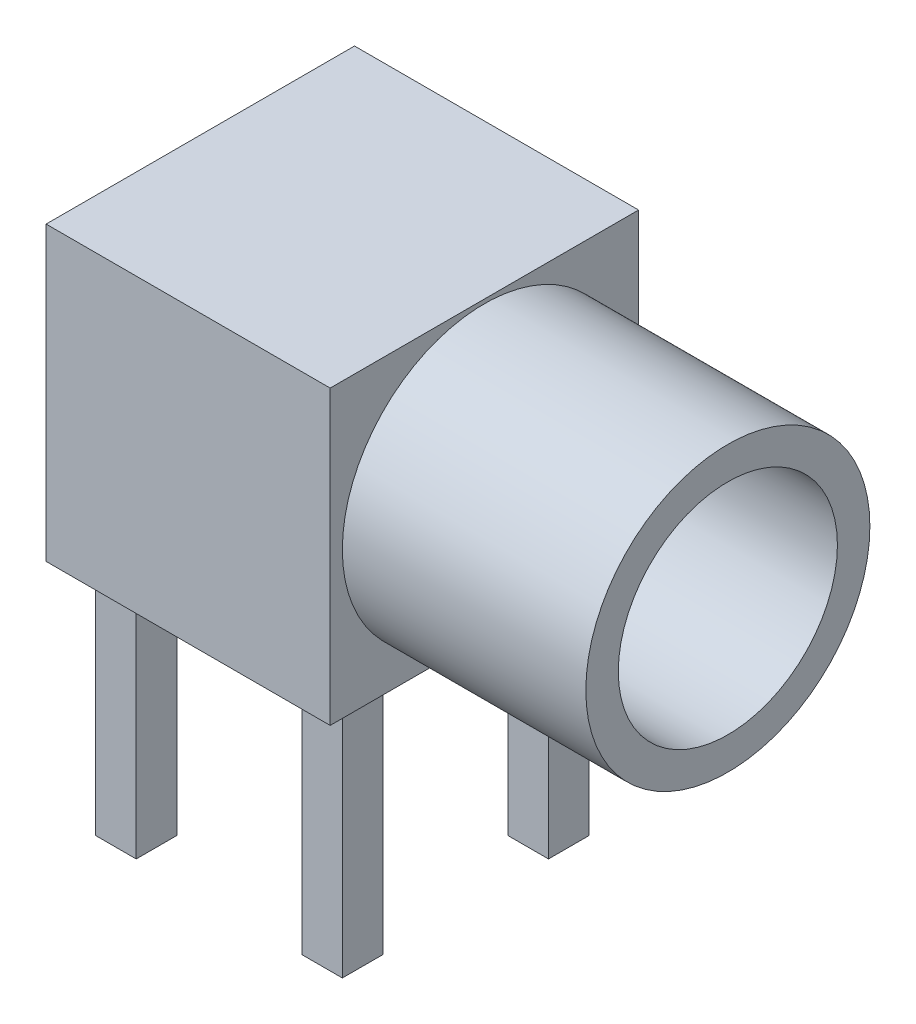
from build123d import *

# Parameters (mm, degrees)
SKETCH1_W           = 3.5
SKETCH1_H           = 3.8
BOSS_EXTRUDE1_DEPTH = 3.6
SKETCH2_R           = 1.75
SKETCH2_R_2         = 1.35
BOSS_EXTRUDE2_DEPTH = 3
SKETCH3_W           = 0.5
SKETCH3_H           = 0.5
BOSS_EXTRUDE3_DEPTH = 3


with BuildPart() as part:
    # Sketch1 → Boss-Extrude1 (new body)
    with BuildSketch(Plane(origin=(0, 0, 0), x_dir=(1, 0, 0), z_dir=(0, 1, 0))):
        Rectangle(SKETCH1_W, SKETCH1_H)
    extrude(amount=BOSS_EXTRUDE1_DEPTH)

    # Sketch2 → Boss-Extrude2 (add)
    with BuildSketch(Plane(origin=(1.75, 0, 0), x_dir=(0, 0, -1), z_dir=(1, 0, 0))):
        with Locations(Location((0, 1.8, 0), (0, 0, 180))):
            Circle(SKETCH2_R)
        with Locations((0, 1.8)):
            Circle(SKETCH2_R_2, mode=Mode.SUBTRACT)
    extrude(amount=BOSS_EXTRUDE2_DEPTH)

    # Sketch3 → Boss-Extrude3 (add)
    with BuildSketch(Plane.XZ):
        with Locations((-1.27, 1.27)):
            Rectangle(SKETCH3_W, SKETCH3_H)
        with Locations((-1.27, -1.27)):
            Rectangle(SKETCH3_W, SKETCH3_H)
        with Locations((1.27, 1.27)):
            Rectangle(SKETCH3_W, SKETCH3_H)
        with Locations((1.27, -1.27)):
            Rectangle(SKETCH3_W, SKETCH3_H)
    extrude(amount=BOSS_EXTRUDE3_DEPTH)


solid = part.part
